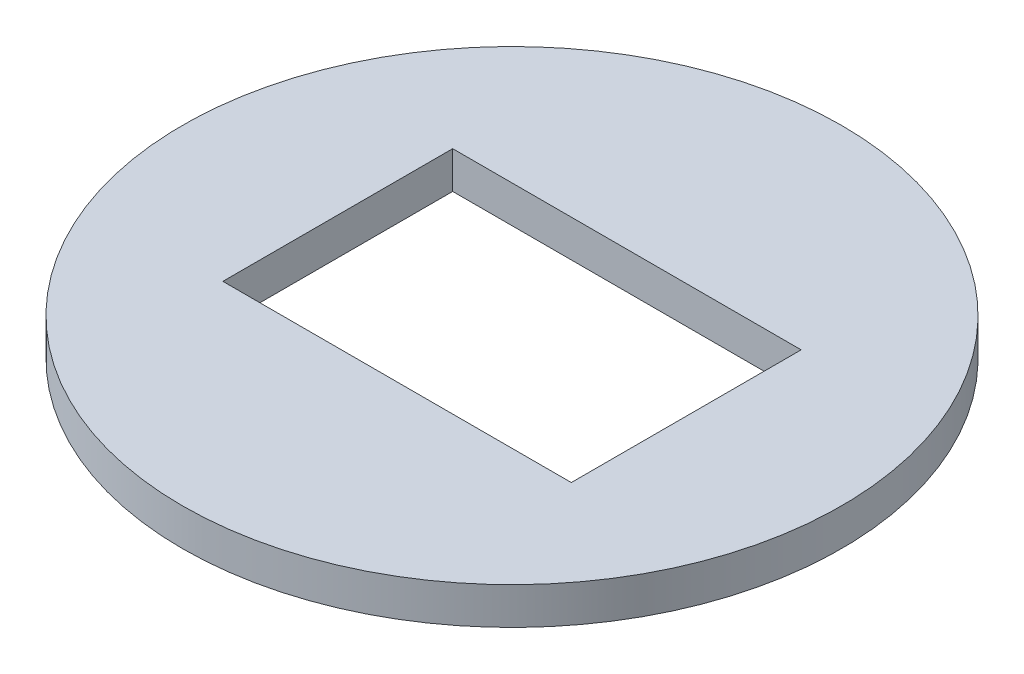
from build123d import *

# Parameters (mm, degrees)
SKETCH1_R           = 88.9
BOSS_EXTRUDE1_DEPTH = 10
SKETCH4_W           = 94
SKETCH4_H           = 62
CUT_EXTRUDE3_DEPTH  = 30


with BuildPart() as part:
    # Sketch1 → Boss-Extrude1 (new body)
    with BuildSketch(Plane(origin=(0, 0, 0), x_dir=(1, 0, 0), z_dir=(0, 1, 0))):
        with Locations(Location((0, 0, 0), (0, 0, 270))):
            Circle(SKETCH1_R)
    extrude(amount=BOSS_EXTRUDE1_DEPTH)

    # Sketch4 → Cut-Extrude3 (cut)
    with BuildSketch(Plane.XZ.offset(20)):
        Rectangle(SKETCH4_W, SKETCH4_H)
    extrude(amount=-CUT_EXTRUDE3_DEPTH, mode=Mode.SUBTRACT)


solid = part.part
